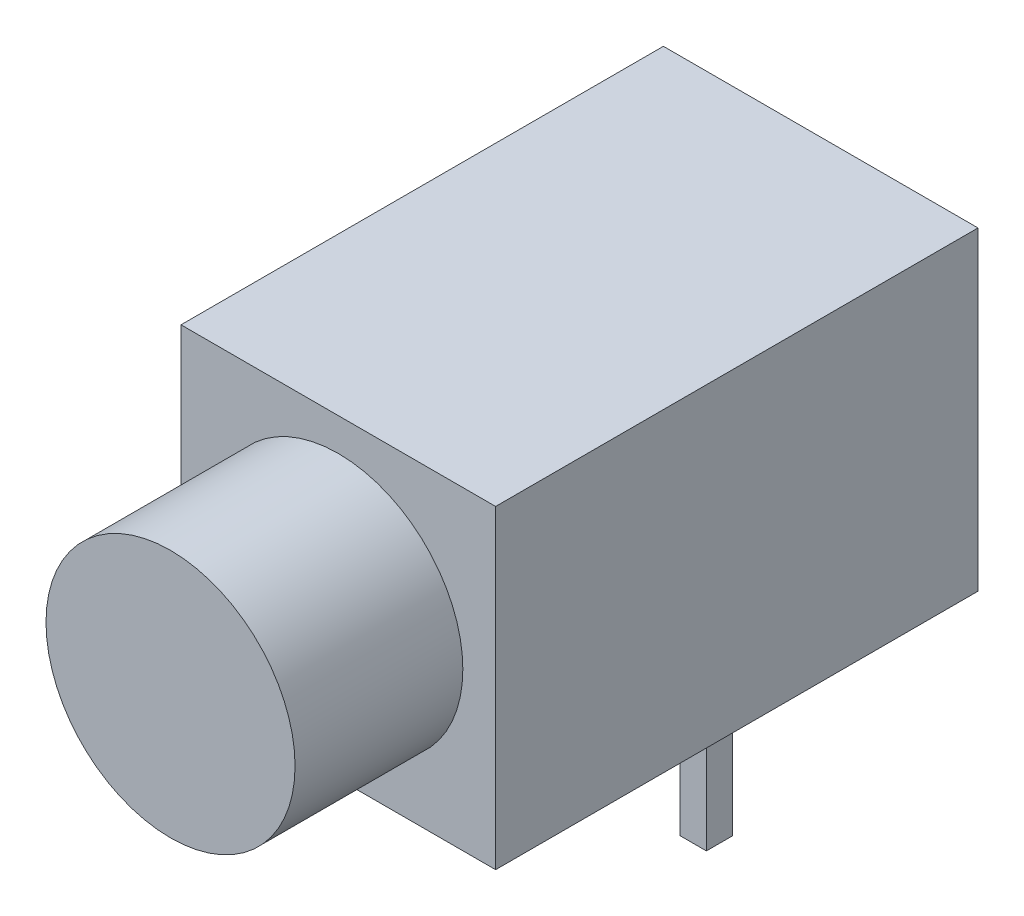
from build123d import *

# Parameters (mm, degrees)
SKETCH2_W           = 6
SKETCH2_H           = 9.2
BOSS_EXTRUDE1_DEPTH = 6
SKETCH3_R           = 2.375
BOSS_EXTRUDE2_DEPTH = 3.2
SKETCH4_W           = 0.5
SKETCH4_H           = 0.5
BOSS_EXTRUDE3_DEPTH = 3.18


with BuildPart() as part:
    # Sketch2 → Boss-Extrude1 (new body)
    with BuildSketch(Plane(origin=(0, 0, 0), x_dir=(1, 0, 0), z_dir=(0, 1, 0))):
        with Locations((3, 4.6)):
            Rectangle(SKETCH2_W, SKETCH2_H)
    extrude(amount=BOSS_EXTRUDE1_DEPTH)

    # Sketch3 → Boss-Extrude2 (add)
    with BuildSketch(Plane.XY):
        with Locations((3, 3)):
            Circle(SKETCH3_R)
    extrude(amount=BOSS_EXTRUDE2_DEPTH)

    # Sketch4 → Boss-Extrude3 (add)
    with BuildSketch(Plane.XZ):
        with Locations((1.73, -5.75)):
            Rectangle(SKETCH4_W, SKETCH4_H)
        with Locations((4.27, -5.75)):
            Rectangle(SKETCH4_W, SKETCH4_H)
    extrude(amount=BOSS_EXTRUDE3_DEPTH)


solid = part.part
